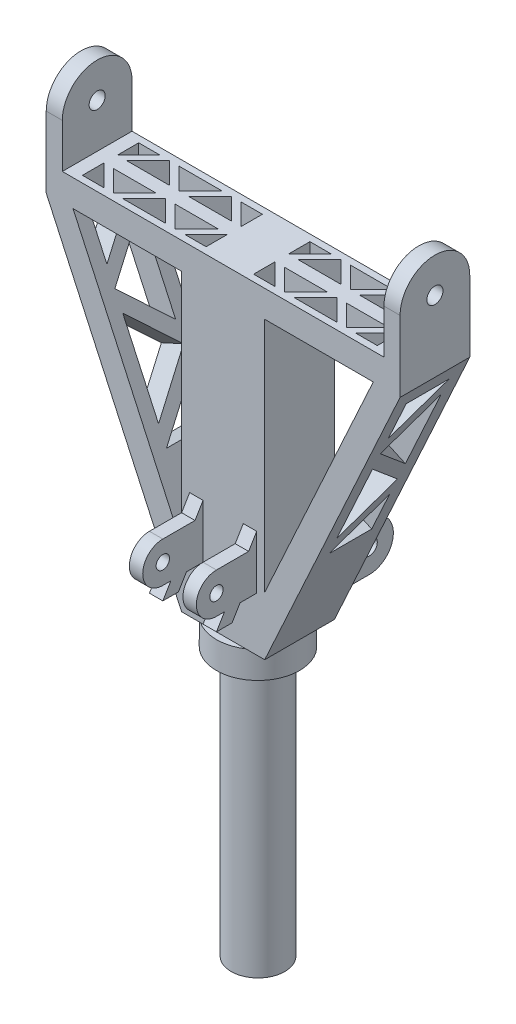
from build123d import *

# Parameters (mm, degrees)
TYKKELSE_LEDDFESTER_OG_BREDDE_H_YDE_SELV_DEPTH = 13
SKETCH28_R                                     = 15.5
SKETCH28_R_2                                   = 10.5
HULL_TIL_L_RBEN_KARBONFIBERR_R_DEPTH           = 10
SKRUEHULL_LEDDFESTER_DEPTH                     = 167.325734629
SKRUEHULL_LEDDFESTER_DEPTH_BACK                = 167.325734629
SKETCH29_R                                     = 3
SKETCH33_W                                     = 5
SKETCH33_H                                     = 20
BREDDE_OG_AVSTAND_STEMPELENDE_DEPTH            = 60
CUT_EXTRUDE4_DEPTH                             = 148.147035308
SIDEM_NSTER_DEPTH                              = 9.088039
SIDEM_NSTER_2_DEPTH                            = 9.088039
UTVIDET_START                                  = -60
SKETCH44_R                                     = 10.5
UTVIDET_L_RBENHULL_INN_I_SELVE_KROPPEN_DEPTH   = 60
M_NSTER_TOPP_DEPTH                             = 10
STEMPELENDE_AV_ST_RSTE_SYLINDER_DEPTH          = 145.150962536
STEMPELENDE_AV_ST_RSTE_SYLINDER_DEPTH_BACK     = 145.150962536
ROD_ENDE_JUSTERE_LENGDEN_ALTS_FESTE_T_R        = 3
SKETCH39_W                                     = 5
SKETCH39_H                                     = 15
SYLINDERFESTE_SELVE_DEN_LILLE_SYLINDERE_DEPTH  = 25
ST_TTER_ST_RSTE_SYLINDER_1_DEPTH               = 5
ST_TTER_ST_RSTE_SYLINDER_2_DEPTH               = 5
SYLINDERFESTE_LITEN_SYLINDER_DEPTH             = 134.515916654
SYLINDERFESTE_LITEN_SYLINDER_DEPTH_BACK        = 134.515916654
SKETCH48_R                                     = 2.5
BOSS_EXTRUDE11_DEPTH                           = 5
BOSS_EXTRUDE12_DEPTH                           = 5
SKETCH51_R                                     = 10
TIL_ASSEMBLY_SLETT_F_R_PRINTING_DEPTH          = 170


with BuildPart() as part:
    # Sketch27 → Tykkelse leddfester og bredde/høyde selve modellen (new, symmetric)
    with BuildSketch(Plane.XY):
        Polygon((66, -50), (-66, -50), (-66, 100), (-60, 100), (-60, 70), (60, 70), (60, 100), (66, 100), align=None)
    extrude(amount=TYKKELSE_LEDDFESTER_OG_BREDDE_H_YDE_SELV_DEPTH, both=True)

    # Sketch28 → Hull til lårben/karbonfiberrør (add)
    with BuildSketch(Plane.XZ.offset(50)):
        with Locations(Location((0, 0, 0), (0, 0, 57.004114526))):
            Circle(SKETCH28_R)
        with Locations(Location((0, 0, 0), (0, 0, 270))):
            Circle(SKETCH28_R_2, mode=Mode.SUBTRACT)
    extrude(amount=HULL_TIL_L_RBEN_KARBONFIBERR_R_DEPTH)

    # Sketch29 → Skruehull leddfester (cut, two sides: drawn at the far end of the back side and taken through both)
    with BuildSketch(Plane(origin=(66, 0, 0), x_dir=(0, 0, -1), z_dir=(1, 0, 0)).offset(-SKRUEHULL_LEDDFESTER_DEPTH_BACK)):
        with Locations((0, 86.5)):
            Circle(SKETCH29_R)
        with BuildLine():
            Line((-13, 86.5), (-13, 71.5))
            Line((-13, 71.5), (-14, 71.5))
            Line((-14, 71.5), (-14, 101))
            Line((-14, 101), (0, 101))
            Line((0, 101), (14, 101))
            Line((14, 101), (14, 71.5))
            Line((14, 71.5), (13, 71.5))
            Line((13, 71.5), (13, 86.5))
            ThreePointArc((13, 86.5), (0, 99.5), (-13, 86.5))
        make_face()
    extrude(amount=SKRUEHULL_LEDDFESTER_DEPTH + SKRUEHULL_LEDDFESTER_DEPTH_BACK, mode=Mode.SUBTRACT)

    # Sketch33 → Bredde og avstand stempelende (add)
    with BuildSketch(Plane(origin=(0, 0, -13), x_dir=(-1, 0, 0), z_dir=(0, 0, -1))):
        with Locations((-6, -40)):
            Rectangle(SKETCH33_W, SKETCH33_H)
        with Locations((6, -40)):
            Rectangle(SKETCH33_W, SKETCH33_H)
    extrude(amount=BREDDE_OG_AVSTAND_STEMPELENDE_DEPTH)

    # Fasong (mønster på selve kroppen) → Cut-Extrude4 (cut, through all)
    with BuildSketch(Plane.XY.offset(13)):
        Polygon((-66, 60), (-15.5, -50), (-66, -50), align=None)
        Polygon((15.5, -50), (66, -50), (66, 60), align=None)
        Polygon((-56, 60), (-15.5, -28.217821782), (-15.5, 60), align=None)
        Polygon((56, 60), (15.5, 60), (15.5, -28.217821782), align=None)
    extrude(amount=-CUT_EXTRUDE4_DEPTH, mode=Mode.SUBTRACT)

    # Sketch40 → Sidemønster (cut)
    with BuildSketch(Plane(origin=(-31.760550161, -14.580979847, 0), x_dir=(0, 0, 1), z_dir=(-0.9088038689830882, -0.41722359439678147, 0))):
        Polygon((-8, 75.564989369), (8, 75.564989369), (8, 59.564989369), align=None)
        Polygon((-8, 68.493921557), (8, 52.493921557), (-8, 36.493921557), align=None)
        Polygon((8, 13.422853745), (-8, 29.422853745), (8, 45.422853745), align=None)
        Polygon((-8, 22.351785934), (8, 6.351785934), (-8, 6.351785934), align=None)
    extrude(amount=-SIDEM_NSTER_DEPTH, mode=Mode.SUBTRACT)

    # Sketch42 → Sidemønster 2 (cut)
    with BuildSketch(Plane(origin=(31.760550161, -14.580979847, 0), x_dir=(0, 0, -1), z_dir=(0.9088038689830882, -0.41722359439678147, 0))):
        Polygon((8, 75.564989369), (-8, 75.564989369), (-8, 59.564989369), align=None)
        Polygon((8, 68.493921557), (-8, 52.493921557), (8, 36.493921557), align=None)
        Polygon((-8, 45.422853745), (8, 29.422853745), (-8, 13.422853745), align=None)
        Polygon((8, 22.351785934), (-8, 6.351785934), (8, 6.351785934), align=None)
    extrude(amount=-SIDEM_NSTER_2_DEPTH, mode=Mode.SUBTRACT)

    # Sketch44 → Utvidet lårbenhull inn i selve kroppen (cut)
    with BuildSketch(Plane.XZ.offset(50).offset(UTVIDET_START)):
        with Locations(Location((0, 0, 0), (0, 0, 270))):
            Circle(SKETCH44_R)
    extrude(amount=UTVIDET_L_RBENHULL_INN_I_SELVE_KROPPEN_DEPTH, mode=Mode.SUBTRACT)

    # Sketch45 → Mønster topp (cut)
    with BuildSketch(Plane(origin=(0, 70, 0), x_dir=(1, 0, 0), z_dir=(0, 1, 0))):
        Polygon((-39.928932188, 10.5), (-31.928932188, 2.5), (-23.928932188, 10.5), align=None)
        Polygon((-16.857864376, 10.5), (-8.857864376, 2.5), (-8.857864376, 10.5), align=None)
        Polygon((-55, 2.5), (-55, 10.5), (-47, 10.5), align=None)
        Polygon((-43.464466094, 10.5), (-51.464466094, 2.5), (-35.464466094, 2.5), align=None)
        Polygon((-20.393398282, 10.5), (-28.393398282, 2.5), (-12.393398282, 2.5), align=None)
        Polygon((-8.857864376, -2.5), (-8.857864376, -10.5), (-16.857864376, -10.5), align=None)
        Polygon((-20.393398282, -10.5), (-12.393398282, -2.5), (-28.393398282, -2.5), align=None)
        Polygon((-23.928932188, -10.5), (-31.928932188, -2.5), (-39.928932188, -10.5), align=None)
        Polygon((-43.464466094, -10.5), (-35.464466094, -2.5), (-51.464466094, -2.5), align=None)
        Polygon((-55, -10.5), (-47, -10.5), (-55, -2.5), align=None)
        Polygon((8.857864376, 2.5), (8.857864376, 10.5), (16.857864376, 10.5), align=None)
        Polygon((16.857864376, -10.5), (8.857864376, -2.5), (8.857864376, -10.5), align=None)
        Polygon((20.393398282, -10.5), (28.393398282, -2.5), (12.393398282, -2.5), align=None)
        Polygon((20.393398282, 10.5), (12.393398282, 2.5), (28.393398282, 2.5), align=None)
        Polygon((23.928932188, 10.5), (31.928932188, 2.5), (39.928932188, 10.5), align=None)
        Polygon((23.928932188, -10.5), (39.928932188, -10.5), (31.928932188, -2.5), align=None)
        Polygon((43.464466094, -10.5), (51.464466094, -2.5), (35.464466094, -2.5), align=None)
        Polygon((55, -2.5), (55, -10.5), (47, -10.5), align=None)
        Polygon((43.464466094, 10.5), (35.464466094, 2.5), (51.464466094, 2.5), align=None)
        Polygon((55, 10.5), (47, 10.5), (55, 2.5), align=None)
    extrude(amount=-M_NSTER_TOPP_DEPTH, mode=Mode.SUBTRACT)

    # Rod-ende, justere lengden (altså feste til største sylinder) → Stempelende av st_rste sylinder (cut, two sides: drawn at the far end of the back side and taken through both)
    with BuildSketch(Plane(origin=(8.5, 0, 0), x_dir=(0, 0, -1), z_dir=(1, 0, 0)).offset(-STEMPELENDE_AV_ST_RSTE_SYLINDER_DEPTH_BACK)):
        with Locations((33, -40)):
            Circle(ROD_ENDE_JUSTERE_LENGDEN_ALTS_FESTE_T_R)
        with BuildLine():
            Line((43, -51), (74, -51))
            Line((74, -51), (74, -29))
            Line((74, -29), (43, -29))
            Line((43, -29), (13, -29))
            Line((13, -29), (13, -31))
            Line((13, -31), (33, -31))
            ThreePointArc((33, -31), (42, -40), (33, -49))
            Line((33, -49), (13, -49))
            Line((13, -49), (13, -51))
            Line((13, -51), (43, -51))
        make_face()
    extrude(amount=STEMPELENDE_AV_ST_RSTE_SYLINDER_DEPTH + STEMPELENDE_AV_ST_RSTE_SYLINDER_DEPTH_BACK, mode=Mode.SUBTRACT)

    # Sketch39 → Sylinderfeste_ selve den lille sylindere (add)
    with BuildSketch(Plane.XY.offset(13)):
        with Locations((-10, -22.5)):
            Rectangle(SKETCH39_W, SKETCH39_H)
        with Locations((10, -22.5)):
            Rectangle(SKETCH39_W, SKETCH39_H)
    extrude(amount=SYLINDERFESTE_SELVE_DEN_LILLE_SYLINDERE_DEPTH)

    # Sketch46 → Støtter største sylinder 1 (add)
    with BuildSketch(Plane(origin=(8.5, 0, 0), x_dir=(0, 0, -1), z_dir=(1, 0, 0))):
        Polygon((13, -6), (13, -14.003905297), (26.596875763, -31), (33, -31), align=None)
    extrude(amount=-ST_TTER_ST_RSTE_SYLINDER_1_DEPTH)

    # Sketch47 → Støtter største sylinder 2 (add)
    with BuildSketch(Plane.ZY.offset(8.5)):
        Polygon((-33, -31), (-13, -6), (-13, -14.003905297), (-26.596875763, -31), align=None)
    extrude(amount=-ST_TTER_ST_RSTE_SYLINDER_2_DEPTH)

    # Sketch48 → Sylinderfeste, liten sylinder (cut, two sides: drawn at the far end of the back side and taken through both)
    with BuildSketch(Plane.ZY.offset(12.5).offset(-SYLINDERFESTE_LITEN_SYLINDER_DEPTH_BACK)):
        with Locations(Location((28, -22.5, 0), (0, 0, 270))):
            Circle(SKETCH48_R)
        with BuildLine():
            Line((28, -30), (13.179811187, -30))
            Line((13.179811187, -30), (13.179811187, -31))
            Line((13.179811187, -31), (39, -31))
            Line((39, -31), (39, -14))
            Line((39, -14), (13, -14))
            Line((13, -14), (13, -15))
            Line((13, -15), (28, -15))
            ThreePointArc((28, -15), (35.5, -22.5), (28, -30))
        make_face()
    extrude(amount=SYLINDERFESTE_LITEN_SYLINDER_DEPTH + SYLINDERFESTE_LITEN_SYLINDER_DEPTH_BACK, mode=Mode.SUBTRACT)

    # Sketch49 → Boss-Extrude11 (add)
    with BuildSketch(Plane.ZY.offset(12.5)):
        Polygon((28, -35), (13, -10), (13, -19.718253158), (22.169048105, -35), align=None)
    extrude(amount=-BOSS_EXTRUDE11_DEPTH)

    # Sketch50 → Boss-Extrude12 (add)
    with BuildSketch(Plane(origin=(12.5, 0, 0), x_dir=(0, 0, -1), z_dir=(1, 0, 0))):
        Polygon((-28, -35), (-22.169048105, -35), (-13, -19.718253158), (-13, -10), align=None)
    extrude(amount=-BOSS_EXTRUDE12_DEPTH)

    # Sketch51 → TIL ASSEMBLY - SLETT FØR PRINTING (add)
    with BuildSketch(Plane.XZ.offset(-10)):
        with Locations(Location((0, 0, 0), (0, 0, 270))):
            Circle(SKETCH51_R)
    extrude(amount=TIL_ASSEMBLY_SLETT_F_R_PRINTING_DEPTH)


solid = part.part
